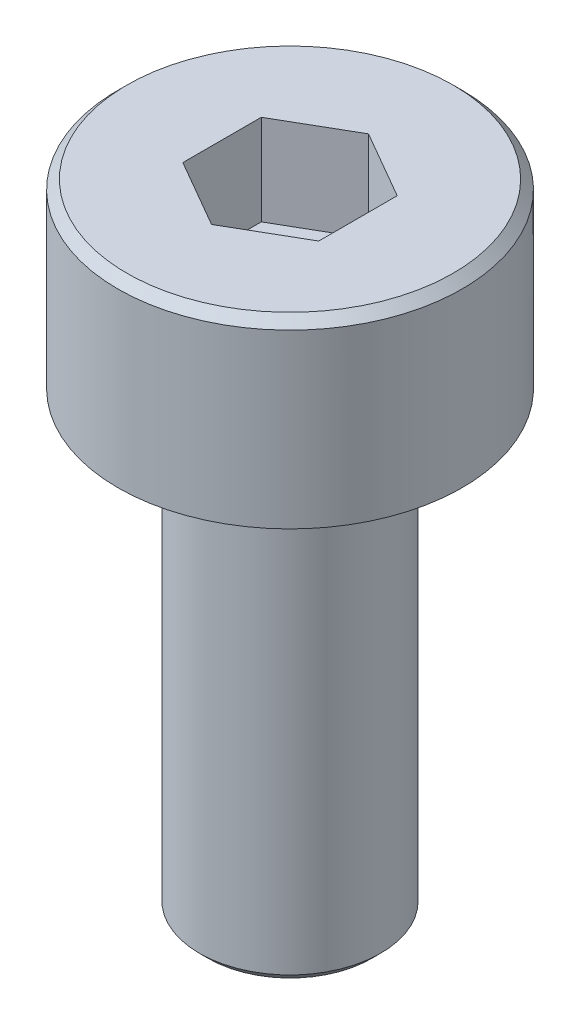
from build123d import *

# Parameters (mm, degrees)
SMUSSO1_SIZE             = 0.1
TAGLIO_ESTRUSIONE1_DEPTH = 1


with BuildPart() as part:
    # Schizzo1 → Rivoluzione1 (revolve)
    with BuildSketch(Plane.XY, mode=Mode.PRIVATE) as rivoluzione1_sk:
        Polygon((0, 0), (0, 2), (1.9, 2), (1.9, 0), (1, 0), (1, -5), (0, -5), align=None)
    revolve(rivoluzione1_sk.sketch.rotate(Axis((0, 28.388481997, 0), (0, -1, 0)), 90), axis=Axis((0, 28.388481997, 0), (0, -1, 0)))

    # Smusso1
    smusso1_edges = [part.edges().sort_by_distance(p)[0] for p in [
        (0, -5, -1),
        (0, 2, -1.9),
    ]]
    chamfer(smusso1_edges, length=SMUSSO1_SIZE)

    # Schizzo2 → Taglio-Estrusione1 (cut)
    with BuildSketch(Plane(origin=(0, 2, 0), x_dir=(1, 0, 0), z_dir=(0, 1, 0))):
        Polygon((0, 0.866025404), (-0.75, 0.433012702), (-0.75, -0.433012702), (0, -0.866025404), (0.75, -0.433012702), (0.75, 0.433012702), align=None)
    extrude(amount=-TAGLIO_ESTRUSIONE1_DEPTH, mode=Mode.SUBTRACT)


solid = part.part
